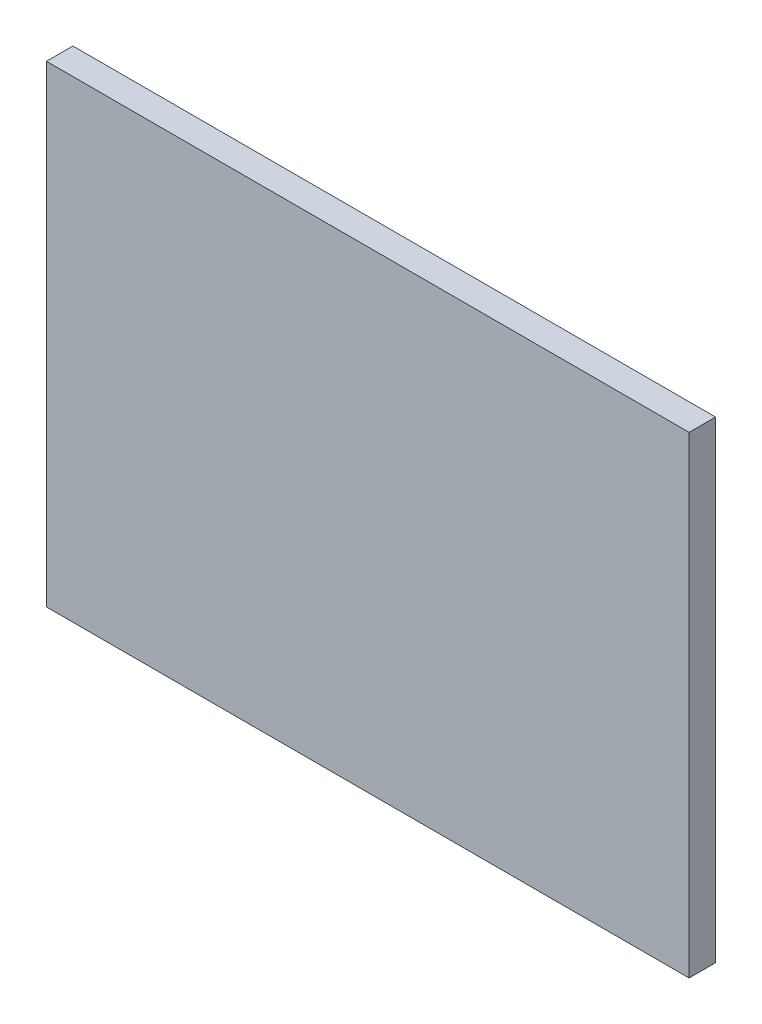
from build123d import *

# Parameters (mm, degrees)
SKETCH_1_W        = 340
SKETCH_1_H        = 250
SKETCH_1_R        = 13
EXTRUDE_456_DEPTH = 14
SKETCH_2_W        = 340
SKETCH_2_H        = 250
EXTRUDE_1_DEPTH   = 14


with BuildPart() as part:
    # 草图1 → Extrude 456 (new body)
    with BuildSketch(Plane.XY):
        Rectangle(SKETCH_1_W, SKETCH_1_H)
        with Locations((-120, 80)):
            Circle(SKETCH_1_R, mode=Mode.SUBTRACT)
        with Locations((-40, 80)):
            Circle(SKETCH_1_R, mode=Mode.SUBTRACT)
        with Locations((-40, 0)):
            Circle(SKETCH_1_R, mode=Mode.SUBTRACT)
        with Locations((-120, 0)):
            Circle(SKETCH_1_R, mode=Mode.SUBTRACT)
        with Locations(Location((-40, -80, 0), (0, 0, 180))):
            Circle(SKETCH_1_R, mode=Mode.SUBTRACT)
        with Locations(Location((-120, -80, 0), (0, 0, 180))):
            Circle(SKETCH_1_R, mode=Mode.SUBTRACT)
        with Locations((120, -80)):
            Circle(SKETCH_1_R, mode=Mode.SUBTRACT)
        with Locations((40, -80)):
            Circle(SKETCH_1_R, mode=Mode.SUBTRACT)
        with Locations(Location((120, 0, 0), (0, 0, 180))):
            Circle(SKETCH_1_R, mode=Mode.SUBTRACT)
        with Locations(Location((40, 0, 0), (0, 0, 180))):
            Circle(SKETCH_1_R, mode=Mode.SUBTRACT)
        with Locations(Location((40, 80, 0), (0, 0, 180))):
            Circle(SKETCH_1_R, mode=Mode.SUBTRACT)
        with Locations(Location((120, 80, 0), (0, 0, 180))):
            Circle(SKETCH_1_R, mode=Mode.SUBTRACT)
    extrude(amount=EXTRUDE_456_DEPTH)

    # 草图2 → 凸台-拉伸1 (add)
    with BuildSketch(Plane.XY.offset(14)):
        Rectangle(SKETCH_2_W, SKETCH_2_H)
    extrude(amount=-EXTRUDE_1_DEPTH)


solid = part.part
